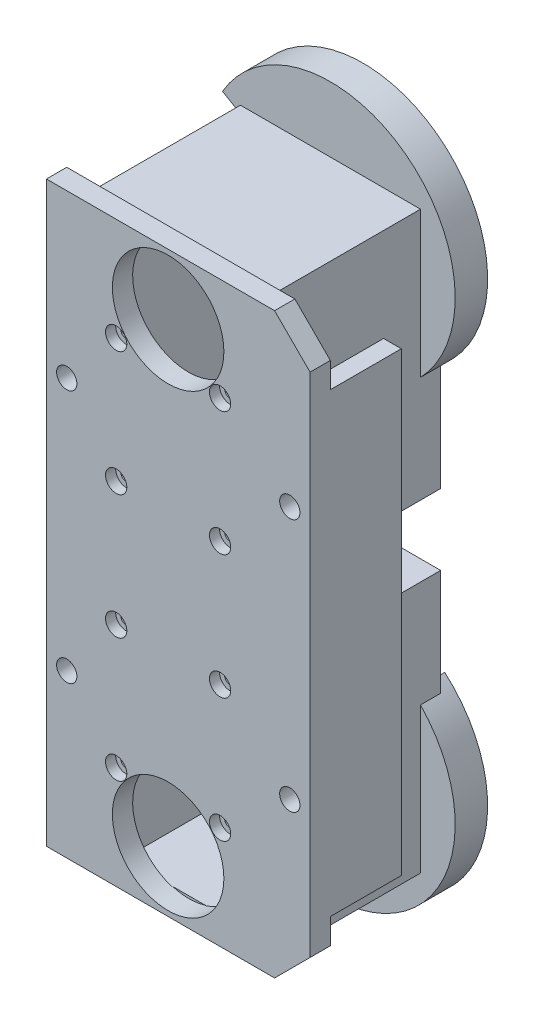
from build123d import *

# Parameters (mm, degrees)
BOSS_1_DEPTH    = 4
S_BOX2_W        = 3.5
S_BOX2_H        = 90
BOSS_2_DEPTH    = 14.5
S_BOX3_W        = 3.5
S_BOX3_H        = 90
BOSS_3_DEPTH    = 14.5
S_BOX4_W        = 35.52
S_BOX4_H        = 2.5
BOSS_4_DEPTH    = 36
S_BOX5_W        = 35.52
S_BOX5_H        = 1.2
BOSS_5_DEPTH    = 36
S_BOX6_W        = 5
S_BOX6_H        = 49.72
BOSS_6_DEPTH    = 36
S_BOX7_W        = 5
S_BOX7_H        = 49.72
BOSS_7_DEPTH    = 36
S_BOX8_W        = 35.52
S_BOX8_H        = 49.72
BOSS_8_DEPTH    = 4
S_CYL9_R        = 19
BOSS_9_DEPTH    = 2.525
BOSS_10_DEPTH   = 6.4
S_BOX11_W       = 35.52
S_BOX11_H       = 1.2
BOSS_11_DEPTH   = 36
S_BOX12_W       = 35.52
S_BOX12_H       = 2.5
BOSS_12_DEPTH   = 36
S_BOX13_W       = 5
S_BOX13_H       = 49.72
BOSS_13_DEPTH   = 36
S_BOX14_W       = 5
S_BOX14_H       = 49.72
BOSS_14_DEPTH   = 36
S_BOX15_W       = 35.52
S_BOX15_H       = 49.72
BOSS_15_DEPTH   = 4
S_CYL16_R       = 19
BOSS_16_DEPTH   = 2.525
BOSS_17_DEPTH   = 6.4
S_HOLE18_R      = 11
HOLE_18_DEPTH   = 4.2
S_HOLE19_R      = 1.1
HOLE_19_DEPTH   = 4.2
S_HOLE20_R      = 2.1
HOLE_20_DEPTH   = 2.1
S_HOLE21_R      = 1.1
HOLE_21_DEPTH   = 4.2
S_HOLE22_R      = 2.1
HOLE_22_DEPTH   = 2.1
S_HOLE23_R      = 1.1
HOLE_23_DEPTH   = 4.2
S_HOLE24_R      = 2.1
HOLE_24_DEPTH   = 2.1
S_HOLE25_R      = 1.1
HOLE_25_DEPTH   = 4.2
S_HOLE26_R      = 2.1
HOLE_26_DEPTH   = 2.1
S_CUT27_W       = 25.52
S_CUT27_H       = 46.02
POCKET_27_DEPTH = 4.075
S_HOLE28_R      = 11.5
HOLE_28_DEPTH   = 2.625
S_HOLE29_R      = 0.9
HOLE_29_DEPTH   = 5.7
S_HOLE30_R      = 0.9
HOLE_30_DEPTH   = 5.7
S_HOLE31_R      = 0.9
HOLE_31_DEPTH   = 5.7
S_HOLE32_R      = 0.9
HOLE_32_DEPTH   = 5.7
S_HOLE33_R      = 11
HOLE_33_DEPTH   = 4.2
S_HOLE34_R      = 1.1
HOLE_34_DEPTH   = 4.2
S_HOLE35_R      = 2.1
HOLE_35_DEPTH   = 2.1
S_HOLE36_R      = 1.1
HOLE_36_DEPTH   = 4.2
S_HOLE37_R      = 2.1
HOLE_37_DEPTH   = 2.1
S_HOLE38_R      = 1.1
HOLE_38_DEPTH   = 4.2
S_HOLE39_R      = 2.1
HOLE_39_DEPTH   = 2.1
S_HOLE40_R      = 1.1
HOLE_40_DEPTH   = 4.2
S_HOLE41_R      = 2.1
HOLE_41_DEPTH   = 2.1
S_CUT42_W       = 25.52
S_CUT42_H       = 46.02
POCKET_42_DEPTH = 4.075
S_HOLE43_R      = 11.5
HOLE_43_DEPTH   = 2.625
S_HOLE44_R      = 0.9
HOLE_44_DEPTH   = 5.7
S_HOLE45_R      = 0.9
HOLE_45_DEPTH   = 5.7
S_HOLE46_R      = 0.9
HOLE_46_DEPTH   = 5.7
S_HOLE47_R      = 0.9
HOLE_47_DEPTH   = 5.7
S_HOLE48_R      = 2
HOLE_48_DEPTH   = 4.2
S_HOLE49_R      = 2
HOLE_49_DEPTH   = 4.2
S_HOLE50_R      = 2
HOLE_50_DEPTH   = 4.2
S_HOLE51_R      = 2
HOLE_51_DEPTH   = 4.2


with BuildPart() as part:
    # S_prism1 → Boss_1 (new body)
    with BuildSketch(Plane.XY.offset(64.625)):
        Polygon((28, -50), (28, 50), (21, 57), (-24, 57), (-24, -57), (21, -57), align=None)
    extrude(amount=BOSS_1_DEPTH)

    # S_box2 → Boss_2 (add)
    with BuildSketch(Plane.XY.offset(50.625)):
        with Locations((26.25, 0)):
            Rectangle(S_BOX2_W, S_BOX2_H)
    extrude(amount=BOSS_2_DEPTH)

    # S_box3 → Boss_3 (add)
    with BuildSketch(Plane.XY.offset(50.625)):
        with Locations((-22.25, 0)):
            Rectangle(S_BOX3_W, S_BOX3_H)
    extrude(amount=BOSS_3_DEPTH)

    # S_box4 → Boss_4 (add)
    with BuildSketch(Plane.XY.offset(32.625)):
        with Locations((0, 8.24)):
            Rectangle(S_BOX4_W, S_BOX4_H)
    extrude(amount=BOSS_4_DEPTH)

    # S_box5 → Boss_5 (add)
    with BuildSketch(Plane.XY.offset(32.625)):
        with Locations((0, 56.11)):
            Rectangle(S_BOX5_W, S_BOX5_H)
    extrude(amount=BOSS_5_DEPTH)

    # S_box6 → Boss_6 (add)
    with BuildSketch(Plane.XY.offset(32.625)):
        with Locations((-15.26, 31.85)):
            Rectangle(S_BOX6_W, S_BOX6_H)
    extrude(amount=BOSS_6_DEPTH)

    # S_box7 → Boss_7 (add)
    with BuildSketch(Plane.XY.offset(32.625)):
        with Locations((15.26, 31.85)):
            Rectangle(S_BOX7_W, S_BOX7_H)
    extrude(amount=BOSS_7_DEPTH)

    # S_box8 → Boss_8 (add)
    with BuildSketch(Plane.XY.offset(64.625)):
        with Locations((0, 31.85)):
            Rectangle(S_BOX8_W, S_BOX8_H)
    extrude(amount=BOSS_8_DEPTH)

    # S_cyl9 → Boss_9 (add)
    with BuildSketch(Plane.XY.offset(30.1)):
        with Locations(Location((0, 45, 0), (0, 0, 200.814328514))):
            Circle(S_CYL9_R)
    extrude(amount=BOSS_9_DEPTH)

    # S_prism10 → Boss_10 (add)
    with BuildSketch(Plane.XY.offset(30.2)):
        with BuildLine():
            Line((-21.304224933, 57.3), (-9.526279442, 50.5))
            ThreePointArc((-9.526279442, 50.5), (6.996860423, 53.487870417), (7.216649319, 36.698194618))
            Line((7.216649319, 36.698194618), (16.139052113, 26.434144327))
            ThreePointArc((16.139052113, 26.434144327), (15.647524219, 63.981964751), (-21.304224933, 57.3))
        make_face()
    extrude(amount=BOSS_10_DEPTH)

    # S_box11 → Boss_11 (add)
    with BuildSketch(Plane.XY.offset(32.625)):
        with Locations((0, -56.11)):
            Rectangle(S_BOX11_W, S_BOX11_H)
    extrude(amount=BOSS_11_DEPTH)

    # S_box12 → Boss_12 (add)
    with BuildSketch(Plane.XY.offset(32.625)):
        with Locations((0, -8.24)):
            Rectangle(S_BOX12_W, S_BOX12_H)
    extrude(amount=BOSS_12_DEPTH)

    # S_box13 → Boss_13 (add)
    with BuildSketch(Plane.XY.offset(32.625)):
        with Locations((-15.26, -31.85)):
            Rectangle(S_BOX13_W, S_BOX13_H)
    extrude(amount=BOSS_13_DEPTH)

    # S_box14 → Boss_14 (add)
    with BuildSketch(Plane.XY.offset(32.625)):
        with Locations((15.26, -31.85)):
            Rectangle(S_BOX14_W, S_BOX14_H)
    extrude(amount=BOSS_14_DEPTH)

    # S_box15 → Boss_15 (add)
    with BuildSketch(Plane.XY.offset(64.625)):
        with Locations((0, -31.85)):
            Rectangle(S_BOX15_W, S_BOX15_H)
    extrude(amount=BOSS_15_DEPTH)

    # S_cyl16 → Boss_16 (add)
    with BuildSketch(Plane.XY.offset(30.1)):
        with Locations(Location((0, -45, 0), (0, 0, 200.814328514))):
            Circle(S_CYL16_R)
    extrude(amount=BOSS_16_DEPTH)

    # S_prism17 → Boss_17 (add)
    with BuildSketch(Plane.XY.offset(30.2)):
        with BuildLine():
            Line((16.139052113, -26.434144327), (7.216649319, -36.698194618))
            ThreePointArc((7.216649319, -36.698194618), (6.996860423, -53.487870417), (-9.526279442, -50.5))
            Line((-9.526279442, -50.5), (-21.304224933, -57.3))
            ThreePointArc((-21.304224933, -57.3), (15.647524219, -63.981964751), (16.139052113, -26.434144327))
        make_face()
    extrude(amount=BOSS_17_DEPTH)

    # S_hole18 → Hole_18 (cut)
    with BuildSketch(Plane.XY.offset(64.525)):
        with Locations(Location((0, 45, 0), (0, 0, 107.165830165))):
            Circle(S_HOLE18_R)
    extrude(amount=HOLE_18_DEPTH, mode=Mode.SUBTRACT)

    # S_hole19 → Hole_19 (cut)
    with BuildSketch(Plane.XY.offset(64.525)):
        with Locations((-10.25, 36.7)):
            Circle(S_HOLE19_R)
    extrude(amount=HOLE_19_DEPTH, mode=Mode.SUBTRACT)

    # S_hole20 → Hole_20 (cut)
    with BuildSketch(Plane.XY.offset(66.625)):
        with Locations((-10.25, 36.7)):
            Circle(S_HOLE20_R)
    extrude(amount=HOLE_20_DEPTH, mode=Mode.SUBTRACT)

    # S_hole21 → Hole_21 (cut)
    with BuildSketch(Plane.XY.offset(64.525)):
        with Locations((10.25, 36.7)):
            Circle(S_HOLE21_R)
    extrude(amount=HOLE_21_DEPTH, mode=Mode.SUBTRACT)

    # S_hole22 → Hole_22 (cut)
    with BuildSketch(Plane.XY.offset(66.625)):
        with Locations((10.25, 36.7)):
            Circle(S_HOLE22_R)
    extrude(amount=HOLE_22_DEPTH, mode=Mode.SUBTRACT)

    # S_hole23 → Hole_23 (cut)
    with BuildSketch(Plane.XY.offset(64.525)):
        with Locations((-10.25, 12.25)):
            Circle(S_HOLE23_R)
    extrude(amount=HOLE_23_DEPTH, mode=Mode.SUBTRACT)

    # S_hole24 → Hole_24 (cut)
    with BuildSketch(Plane.XY.offset(66.625)):
        with Locations((-10.25, 12.25)):
            Circle(S_HOLE24_R)
    extrude(amount=HOLE_24_DEPTH, mode=Mode.SUBTRACT)

    # S_hole25 → Hole_25 (cut)
    with BuildSketch(Plane.XY.offset(64.525)):
        with Locations((10.25, 12.25)):
            Circle(S_HOLE25_R)
    extrude(amount=HOLE_25_DEPTH, mode=Mode.SUBTRACT)

    # S_hole26 → Hole_26 (cut)
    with BuildSketch(Plane.XY.offset(66.625)):
        with Locations((10.25, 12.25)):
            Circle(S_HOLE26_R)
    extrude(amount=HOLE_26_DEPTH, mode=Mode.SUBTRACT)

    # S_cut27 → Pocket_27 (cut)
    with BuildSketch(Plane.XY.offset(32.625)):
        with Locations((0, 32.5)):
            Rectangle(S_CUT27_W, S_CUT27_H)
    extrude(amount=POCKET_27_DEPTH, mode=Mode.SUBTRACT)

    # S_hole28 → Hole_28 (cut)
    with BuildSketch(Plane.XY.offset(30.1)):
        with Locations(Location((0, 45, 0), (0, 0, 113.948166611))):
            Circle(S_HOLE28_R)
    extrude(amount=HOLE_28_DEPTH, mode=Mode.SUBTRACT)

    # S_hole29 → Hole_29 (cut)
    with BuildSketch(Plane.XY.offset(30.1)):
        with Locations((19.938771315, 35.702398242)):
            Circle(S_HOLE29_R)
    extrude(amount=HOLE_29_DEPTH, mode=Mode.SUBTRACT)

    # S_hole30 → Hole_30 (cut)
    with BuildSketch(Plane.XY.offset(30.1)):
        with Locations((21.250368178, 50.694018992)):
            Circle(S_HOLE30_R)
    extrude(amount=HOLE_30_DEPTH, mode=Mode.SUBTRACT)

    # S_hole31 → Hole_31 (cut)
    with BuildSketch(Plane.XY.offset(30.1)):
        with Locations((12.6186816, 63.021344974)):
            Circle(S_HOLE31_R)
    extrude(amount=HOLE_31_DEPTH, mode=Mode.SUBTRACT)

    # S_hole32 → Hole_32 (cut)
    with BuildSketch(Plane.XY.offset(30.1)):
        with Locations((0.767788927, 66.986598194)):
            Circle(S_HOLE32_R)
    extrude(amount=HOLE_32_DEPTH, mode=Mode.SUBTRACT)

    # S_hole33 → Hole_33 (cut)
    with BuildSketch(Plane.XY.offset(64.525)):
        with Locations(Location((0, -45, 0), (0, 0, 252.834169835))):
            Circle(S_HOLE33_R)
    extrude(amount=HOLE_33_DEPTH, mode=Mode.SUBTRACT)

    # S_hole34 → Hole_34 (cut)
    with BuildSketch(Plane.XY.offset(64.525)):
        with Locations((-10.25, -36.7)):
            Circle(S_HOLE34_R)
    extrude(amount=HOLE_34_DEPTH, mode=Mode.SUBTRACT)

    # S_hole35 → Hole_35 (cut)
    with BuildSketch(Plane.XY.offset(66.625)):
        with Locations((-10.25, -36.7)):
            Circle(S_HOLE35_R)
    extrude(amount=HOLE_35_DEPTH, mode=Mode.SUBTRACT)

    # S_hole36 → Hole_36 (cut)
    with BuildSketch(Plane.XY.offset(64.525)):
        with Locations((10.25, -36.7)):
            Circle(S_HOLE36_R)
    extrude(amount=HOLE_36_DEPTH, mode=Mode.SUBTRACT)

    # S_hole37 → Hole_37 (cut)
    with BuildSketch(Plane.XY.offset(66.625)):
        with Locations((10.25, -36.7)):
            Circle(S_HOLE37_R)
    extrude(amount=HOLE_37_DEPTH, mode=Mode.SUBTRACT)

    # S_hole38 → Hole_38 (cut)
    with BuildSketch(Plane.XY.offset(64.525)):
        with Locations((-10.25, -12.25)):
            Circle(S_HOLE38_R)
    extrude(amount=HOLE_38_DEPTH, mode=Mode.SUBTRACT)

    # S_hole39 → Hole_39 (cut)
    with BuildSketch(Plane.XY.offset(66.625)):
        with Locations((-10.25, -12.25)):
            Circle(S_HOLE39_R)
    extrude(amount=HOLE_39_DEPTH, mode=Mode.SUBTRACT)

    # S_hole40 → Hole_40 (cut)
    with BuildSketch(Plane.XY.offset(64.525)):
        with Locations((10.25, -12.25)):
            Circle(S_HOLE40_R)
    extrude(amount=HOLE_40_DEPTH, mode=Mode.SUBTRACT)

    # S_hole41 → Hole_41 (cut)
    with BuildSketch(Plane.XY.offset(66.625)):
        with Locations((10.25, -12.25)):
            Circle(S_HOLE41_R)
    extrude(amount=HOLE_41_DEPTH, mode=Mode.SUBTRACT)

    # S_cut42 → Pocket_42 (cut)
    with BuildSketch(Plane.XY.offset(32.625)):
        with Locations((0, -32.5)):
            Rectangle(S_CUT42_W, S_CUT42_H)
    extrude(amount=POCKET_42_DEPTH, mode=Mode.SUBTRACT)

    # S_hole43 → Hole_43 (cut)
    with BuildSketch(Plane.XY.offset(30.1)):
        with Locations(Location((0, -45, 0), (0, 0, 246.051833389))):
            Circle(S_HOLE43_R)
    extrude(amount=HOLE_43_DEPTH, mode=Mode.SUBTRACT)

    # S_hole44 → Hole_44 (cut)
    with BuildSketch(Plane.XY.offset(30.1)):
        with Locations((19.938771315, -35.702398242)):
            Circle(S_HOLE44_R)
    extrude(amount=HOLE_44_DEPTH, mode=Mode.SUBTRACT)

    # S_hole45 → Hole_45 (cut)
    with BuildSketch(Plane.XY.offset(30.1)):
        with Locations((21.250368178, -50.694018992)):
            Circle(S_HOLE45_R)
    extrude(amount=HOLE_45_DEPTH, mode=Mode.SUBTRACT)

    # S_hole46 → Hole_46 (cut)
    with BuildSketch(Plane.XY.offset(30.1)):
        with Locations((12.6186816, -63.021344974)):
            Circle(S_HOLE46_R)
    extrude(amount=HOLE_46_DEPTH, mode=Mode.SUBTRACT)

    # S_hole47 → Hole_47 (cut)
    with BuildSketch(Plane.XY.offset(30.1)):
        with Locations((0.767788927, -66.986598194)):
            Circle(S_HOLE47_R)
    extrude(amount=HOLE_47_DEPTH, mode=Mode.SUBTRACT)

    # S_hole48 → Hole_48 (cut)
    with BuildSketch(Plane.XY.offset(64.525)):
        with Locations(Location((-20, -25, 0), (0, 0, 255.522487814))):
            Circle(S_HOLE48_R)
    extrude(amount=HOLE_48_DEPTH, mode=Mode.SUBTRACT)

    # S_hole49 → Hole_49 (cut)
    with BuildSketch(Plane.XY.offset(64.525)):
        with Locations(Location((-20, 25, 0), (0, 0, 255.522487814))):
            Circle(S_HOLE49_R)
    extrude(amount=HOLE_49_DEPTH, mode=Mode.SUBTRACT)

    # S_hole50 → Hole_50 (cut)
    with BuildSketch(Plane.XY.offset(64.525)):
        with Locations(Location((24, -25, 0), (0, 0, 284.477512186))):
            Circle(S_HOLE50_R)
    extrude(amount=HOLE_50_DEPTH, mode=Mode.SUBTRACT)

    # S_hole51 → Hole_51 (cut)
    with BuildSketch(Plane.XY.offset(64.525)):
        with Locations(Location((24, 25, 0), (0, 0, 284.477512186))):
            Circle(S_HOLE51_R)
    extrude(amount=HOLE_51_DEPTH, mode=Mode.SUBTRACT)


solid = part.part
